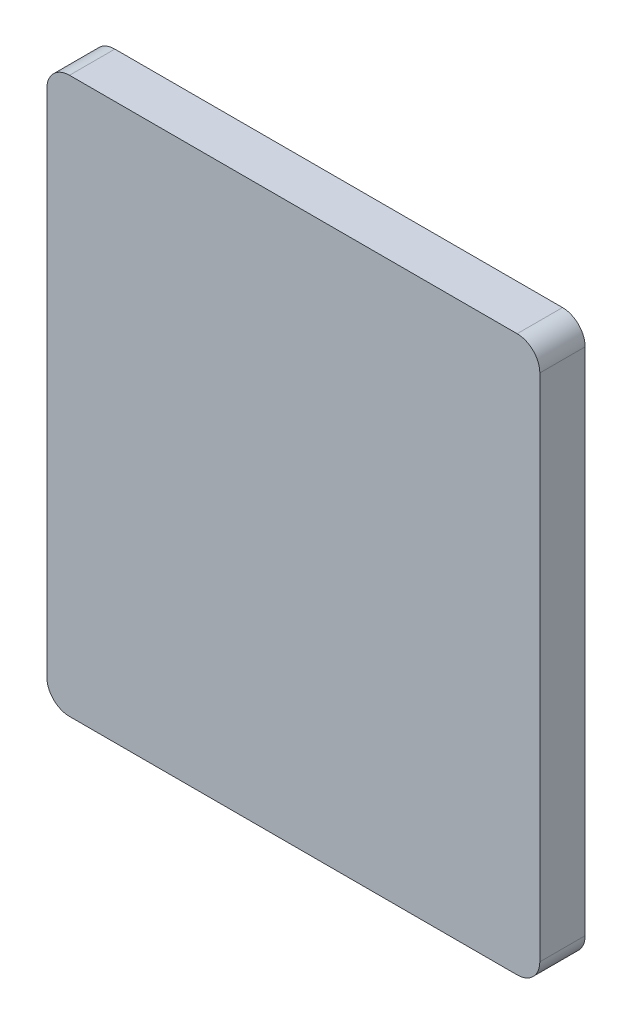
from build123d import *

# Parameters (mm, degrees)
BOSS_EXTRUDE1_DEPTH = 8


with BuildPart() as part:
    # Sketch1 → Boss-Extrude1 (new body)
    with BuildSketch(Plane.XY):
        with BuildLine():
            Line((39.5, -49), (-39.5, -49))
            ThreePointArc((-39.5, -49), (-42.328427125, -47.828427125), (-43.5, -45))
            Line((-43.5, -45), (-43.5, 45))
            ThreePointArc((-43.5, 45), (-42.328427125, 47.828427125), (-39.5, 49))
            Line((-39.5, 49), (39.5, 49))
            ThreePointArc((39.5, 49), (42.328427125, 47.828427125), (43.5, 45))
            Line((43.5, 45), (43.5, -45))
            ThreePointArc((43.5, -45), (42.328427125, -47.828427125), (39.5, -49))
        make_face()
    extrude(amount=BOSS_EXTRUDE1_DEPTH)


solid = part.part
